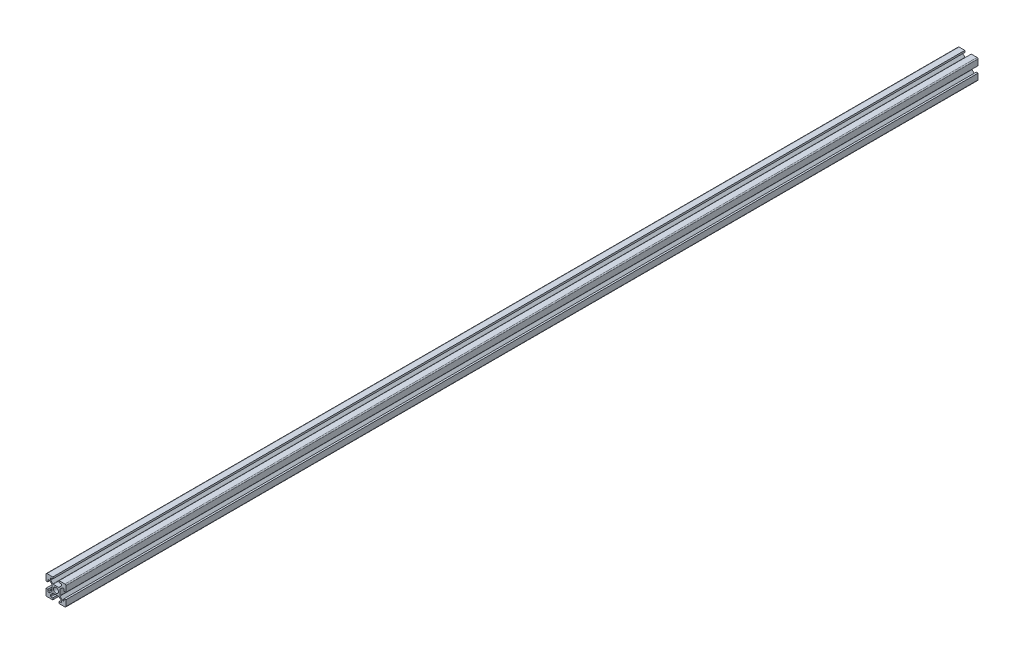
from build123d import *

# Parameters (mm, degrees)
SKETCH1_R           = 2.5
BOSS_EXTRUDE1_DEPTH = 915
FILLET1_R           = 1
FILLET2_R           = 0.5
FILLET3_R           = 0.5
FILLET4_R           = 0.5
FILLET5_R           = 0.5


with BuildPart() as part:
    # Sketch1 → Boss-Extrude1 (new body)
    with BuildSketch(Plane.XY):
        Polygon((13.2, 0), (13.2, 1.8), (15.45, 1.8), (15.45, 3.6), (12.95, 6.1), (7.05, 6.1), (4.55, 3.6), (4.55, 1.8), (6.8, 1.8), (6.8, 0), (0, 0), (0, 6.8), (1.8, 6.8), (1.8, 4.55), (3.6, 4.55), (6.1, 7.05), (6.1, 12.95), (3.6, 15.45), (1.8, 15.45), (1.8, 13.2), (0, 13.2), (0, 20), (6.8, 20), (6.8, 18.2), (4.55, 18.2), (4.55, 16.4), (7.05, 13.9), (12.95, 13.9), (15.45, 16.4), (15.45, 18.2), (13.2, 18.2), (13.2, 20), (20, 20), (20, 13.2), (18.2, 13.2), (18.2, 15.45), (16.4, 15.45), (13.9, 12.95), (13.9, 7.05), (16.4, 4.55), (18.2, 4.55), (18.2, 6.8), (20, 6.8), (20, 0), align=None)
        with Locations(Location((10, 10, 0), (0, 0, 180))):
            Circle(SKETCH1_R, mode=Mode.SUBTRACT)
    extrude(amount=BOSS_EXTRUDE1_DEPTH)

    # Fillet1
    fillet1_edges = [part.edges().sort_by_distance(p)[0] for p in [
        (0, 0, 457.5),
        (0, 20, 457.5),
        (20, 20, 457.5),
        (20, 0, 457.5),
    ]]
    fillet(fillet1_edges, radius=FILLET1_R)

    # Fillet2
    fillet2_edges = [part.edges().sort_by_distance(p)[0] for p in [
        (4.55, 18.2, 457.5),
        (4.55, 16.4, 457.5),
        (7.05, 13.9, 457.5),
        (12.95, 13.9, 457.5),
        (15.45, 16.4, 457.5),
        (15.45, 18.2, 457.5),
    ]]
    fillet(fillet2_edges, radius=FILLET2_R)

    # Fillet3
    fillet3_edges = [part.edges().sort_by_distance(p)[0] for p in [
        (18.2, 15.45, 457.5),
        (16.4, 15.45, 457.5),
        (13.9, 12.95, 457.5),
        (13.9, 7.05, 457.5),
        (16.4, 4.55, 457.5),
        (18.2, 4.55, 457.5),
    ]]
    fillet(fillet3_edges, radius=FILLET3_R)

    # Fillet4
    fillet4_edges = [part.edges().sort_by_distance(p)[0] for p in [
        (1.8, 4.55, 457.5),
        (3.6, 4.55, 457.5),
        (6.1, 7.05, 457.5),
        (6.1, 12.95, 457.5),
        (3.6, 15.45, 457.5),
        (1.8, 15.45, 457.5),
    ]]
    fillet(fillet4_edges, radius=FILLET4_R)

    # Fillet5
    fillet5_edges = [part.edges().sort_by_distance(p)[0] for p in [
        (15.45, 1.8, 457.5),
        (15.45, 3.6, 457.5),
        (12.95, 6.1, 457.5),
        (7.05, 6.1, 457.5),
        (4.55, 3.6, 457.5),
        (4.55, 1.8, 457.5),
    ]]
    fillet(fillet5_edges, radius=FILLET5_R)


solid = part.part
